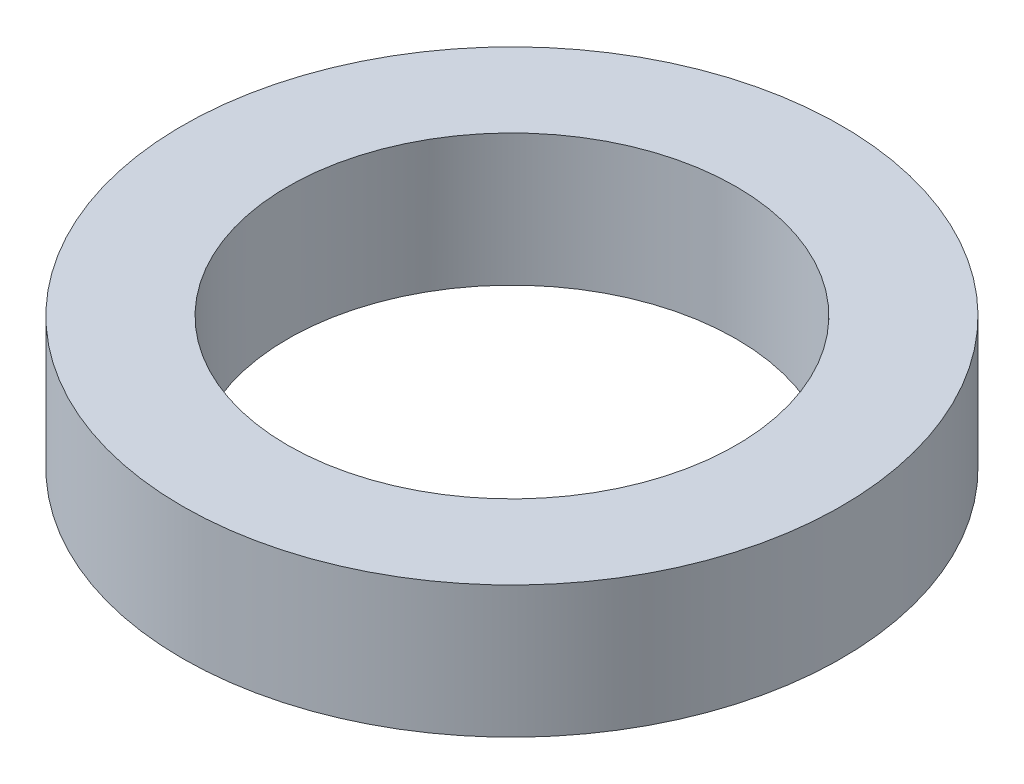
from build123d import *

# Parameters (mm, degrees)
SKETCH1_R                = 2.5
BOSS_EXTRUDE1_DEPTH      = 1
M3_CLEARANCE_HOLE1_D     = 3.4
M3_CLEARANCE_HOLE1_DEPTH = 10
M3_CLEARANCE_HOLE1_TIP   = 1.021463052


with BuildPart() as part:
    # Sketch1 → Boss-Extrude1 (new body)
    with BuildSketch(Plane(origin=(0, 0, 0), x_dir=(1, 0, 0), z_dir=(0, 1, 0))):
        with Locations(Location((0, 0, 0), (0, 0, 270))):
            Circle(SKETCH1_R)
    extrude(amount=BOSS_EXTRUDE1_DEPTH)

    # M3 Clearance Hole1
    with Locations(Plane(origin=(0, 0, 0), x_dir=(-1, 0, 0), z_dir=(0, -1, 0))):
        with Locations((0, 0)):
            Hole(M3_CLEARANCE_HOLE1_D / 2, depth=M3_CLEARANCE_HOLE1_DEPTH)
            with Locations((0, 0, -(M3_CLEARANCE_HOLE1_DEPTH + M3_CLEARANCE_HOLE1_TIP / 2))):  # 118° drill point
                Cone(0, M3_CLEARANCE_HOLE1_D / 2, M3_CLEARANCE_HOLE1_TIP, mode=Mode.SUBTRACT)


solid = part.part
